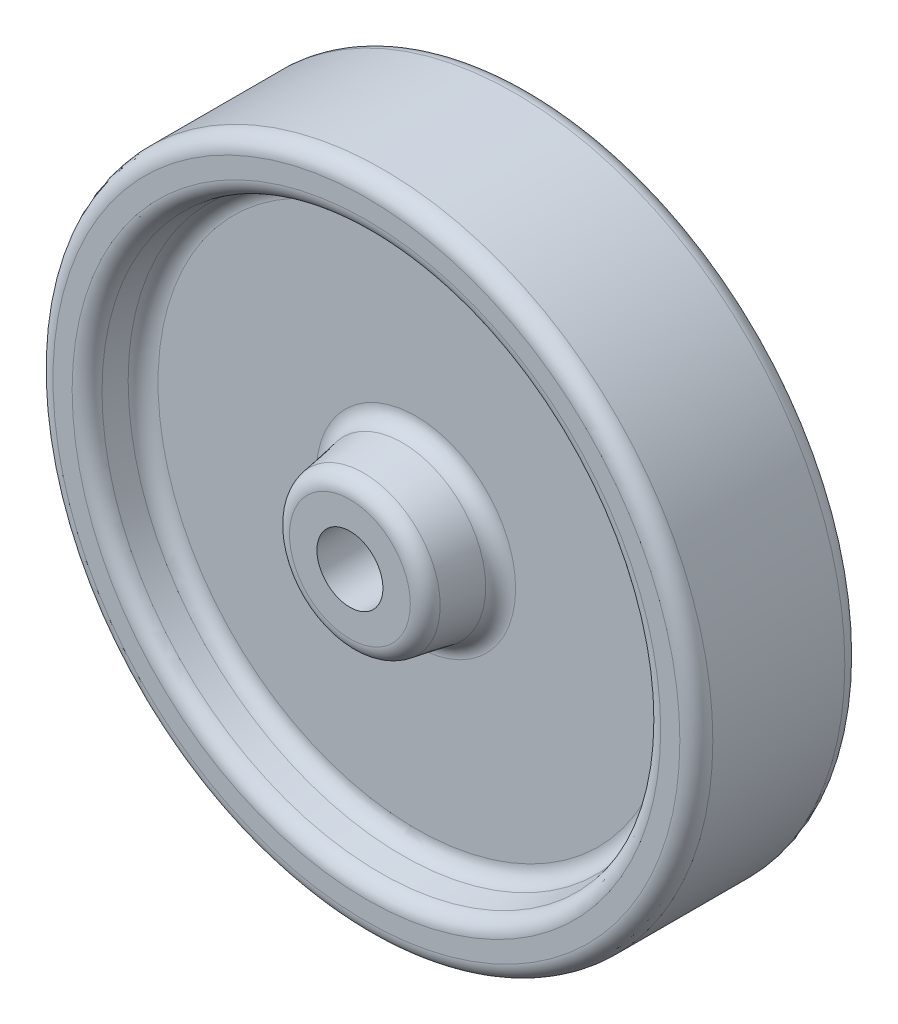
from build123d import *

# Parameters (mm, degrees)
ESTRUSIONE1_START = -60
SCHIZZO2_R        = 12.5
SCHIZZO2_R_2      = 10
ESTRUSIONE1_DEPTH = 60


with BuildPart() as part:
    # Schizzo1 → Rivoluzione1 (revolve)
    with BuildSketch(Plane(origin=(0, 0, 0), x_dir=(0, 0, -1), z_dir=(1, 0, 0)), mode=Mode.PRIVATE) as rivoluzione1_sk:
        with BuildLine():
            Line((-20, 100), (20, 100))
            ThreePointArc((20, 100), (23.535533906, 98.535533906), (25, 95))
            Line((25, 95), (25, 89.195498156))
            ThreePointArc((25, 89.195498156), (23.830222216, 85.981560107), (20.868240888, 84.271459391))
            Line((20.868240888, 84.271459391), (14.131759112, 83.083635899))
            ThreePointArc((14.131759112, 83.083635899), (11.169777784, 81.373535182), (10, 78.159597133))
            Line((10, 78.159597133), (10, 30.22203777))
            ThreePointArc((10, 30.22203777), (11.169777784, 27.008099722), (14.131759112, 25.297999005))
            Line((14.131759112, 25.297999005), (25.868240888, 23.228540609))
            ThreePointArc((25.868240888, 23.228540609), (28.830222216, 21.518439893), (30, 18.304501844))
            Line((30, 18.304501844), (30, 12.5))
            Line((30, 12.5), (-30, 12.5))
            Line((-30, 12.5), (-30, 18.304501844))
            ThreePointArc((-30, 18.304501844), (-28.830222216, 21.518439893), (-25.868240888, 23.228540609))
            Line((-25.868240888, 23.228540609), (-14.131759112, 25.297999005))
            ThreePointArc((-14.131759112, 25.297999005), (-11.169777784, 27.008099722), (-10, 30.22203777))
            Line((-10, 30.22203777), (-10, 78.159597133))
            ThreePointArc((-10, 78.159597133), (-11.169777784, 81.373535182), (-14.131759112, 83.083635899))
            Line((-14.131759112, 83.083635899), (-20.868240888, 84.271459391))
            ThreePointArc((-20.868240888, 84.271459391), (-23.830222216, 85.981560107), (-25, 89.195498156))
            Line((-25, 89.195498156), (-25, 95))
            ThreePointArc((-25, 95), (-23.535533906, 98.535533906), (-20, 100))
        make_face()
    revolve(rivoluzione1_sk.sketch.rotate(Axis((0, 0, 0), (0, 0, -1)), 90), axis=Axis((0, 0, 0), (0, 0, -1)))

    # Schizzo2 → Estrusione1 (add)
    with BuildSketch(Plane(origin=(0, 0, -30), x_dir=(-1, 0, 0), z_dir=(0, 0, -1)).offset(ESTRUSIONE1_START)):
        Circle(SCHIZZO2_R)
        Circle(SCHIZZO2_R_2, mode=Mode.SUBTRACT)
    extrude(amount=ESTRUSIONE1_DEPTH)


solid = part.part
